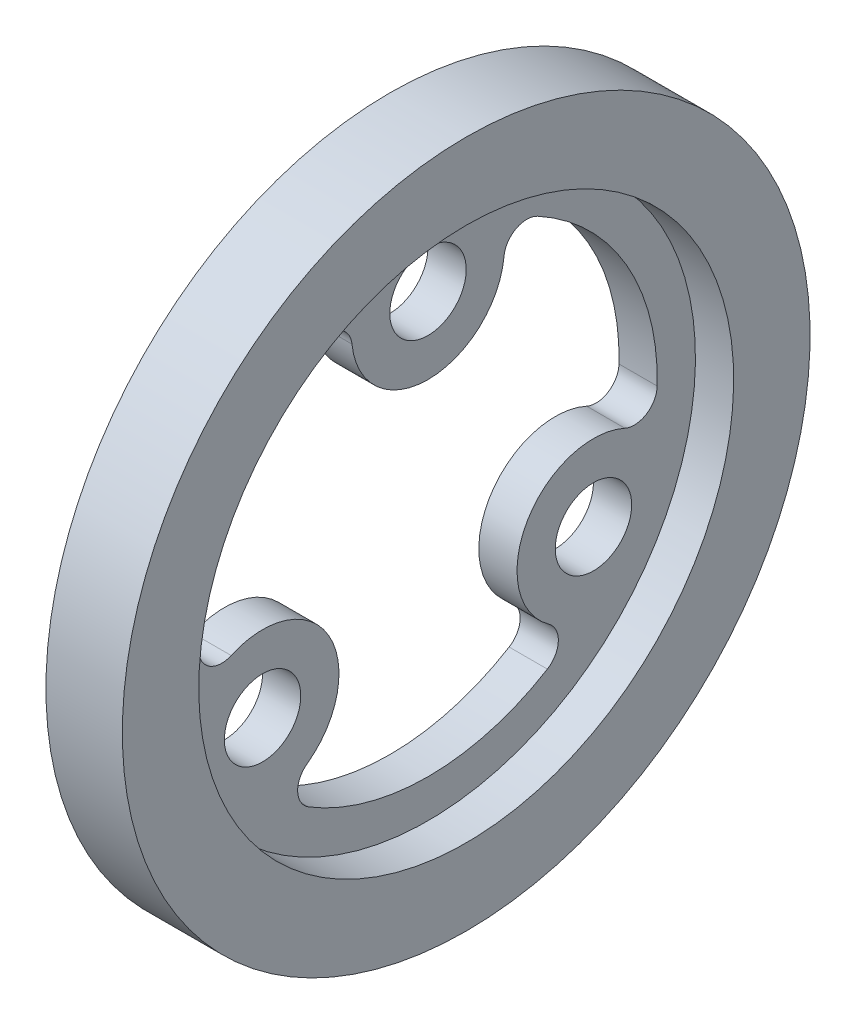
from build123d import *

# Parameters (mm, degrees)
CROQUIS1_W            = 10
CROQUIS1_H            = 45
CROQUIS2_R            = 35
CORTAR_EXTRUIR1_DEPTH = 5
CROQUIS4_R            = 5
CORTAR_EXTRUIR3_DEPTH = 5


with BuildPart() as part:
    # Croquis1 → Revolución1 (revolve)
    with BuildSketch(Plane.XY, mode=Mode.PRIVATE) as revoluci_n1_sk:
        with Locations((5, 22.5)):
            Rectangle(CROQUIS1_W, CROQUIS1_H)
    revolve(revoluci_n1_sk.sketch.rotate(Axis((0, 0, 0), (1, 0, 0)), 180), axis=Axis((0, 0, 0), (1, 0, 0)))

    # Croquis2 → Cortar-Extruir1 (cut)
    with BuildSketch(Plane(origin=(10, 0, 0), x_dir=(0, 0, -1), z_dir=(1, 0, 0))):
        with Locations(Location((0, 0, 0), (0, 0, 90))):
            Circle(CROQUIS2_R)
    extrude(amount=-CORTAR_EXTRUIR1_DEPTH, mode=Mode.SUBTRACT)

    # Croquis4 → Cortar-Extruir3 (cut)
    with BuildSketch(Plane(origin=(5, 0, 0), x_dir=(0, 0, -1), z_dir=(1, 0, 0))):
        with BuildLine():
            ThreePointArc((29.991356012, -0.720114266), (25.980762114, 15), (14.372040758, 26.333333333))
            ThreePointArc((14.372040758, 26.333333333), (11.534836682, 26.353299832), (9.949874371, 24))
            ThreePointArc((9.949874371, 24), (0, 15), (-9.949874371, 24))
            ThreePointArc((-9.949874371, 24), (-11.534836682, 26.353299832), (-14.372040758, 26.333333333))
            ThreePointArc((-14.372040758, 26.333333333), (-25.980762114, 15), (-29.991356012, -0.720114266))
            ThreePointArc((-29.991356012, -0.720114266), (-28.590045469, -3.187188321), (-25.759546876, -3.38315603))
            ThreePointArc((-25.759546876, -3.38315603), (-12.990381057, -7.5), (-15.809672505, -20.61684397))
            ThreePointArc((-15.809672505, -20.61684397), (-17.055208787, -23.166111512), (-15.619315254, -25.613219068))
            ThreePointArc((-15.619315254, -25.613219068), (0, -30), (15.619315254, -25.613219067))
            ThreePointArc((15.619315254, -25.613219067), (17.055208787, -23.166111512), (15.809672505, -20.61684397))
            ThreePointArc((15.809672505, -20.61684397), (12.990381057, -7.5), (25.759546876, -3.38315603))
            ThreePointArc((25.759546876, -3.38315603), (28.59004547, -3.187188321), (29.991356012, -0.720114266))
        make_face()
        with Locations(Location((0, 25, 0), (0, 0, 90))):
            Circle(CROQUIS4_R)
        with Locations(Location((21.650635095, -12.5, 0), (0, 0, 90))):
            Circle(CROQUIS4_R)
        with Locations(Location((-21.650635095, -12.5, 0), (0, 0, 90))):
            Circle(CROQUIS4_R)
    extrude(amount=-CORTAR_EXTRUIR3_DEPTH, mode=Mode.SUBTRACT)


solid = part.part
